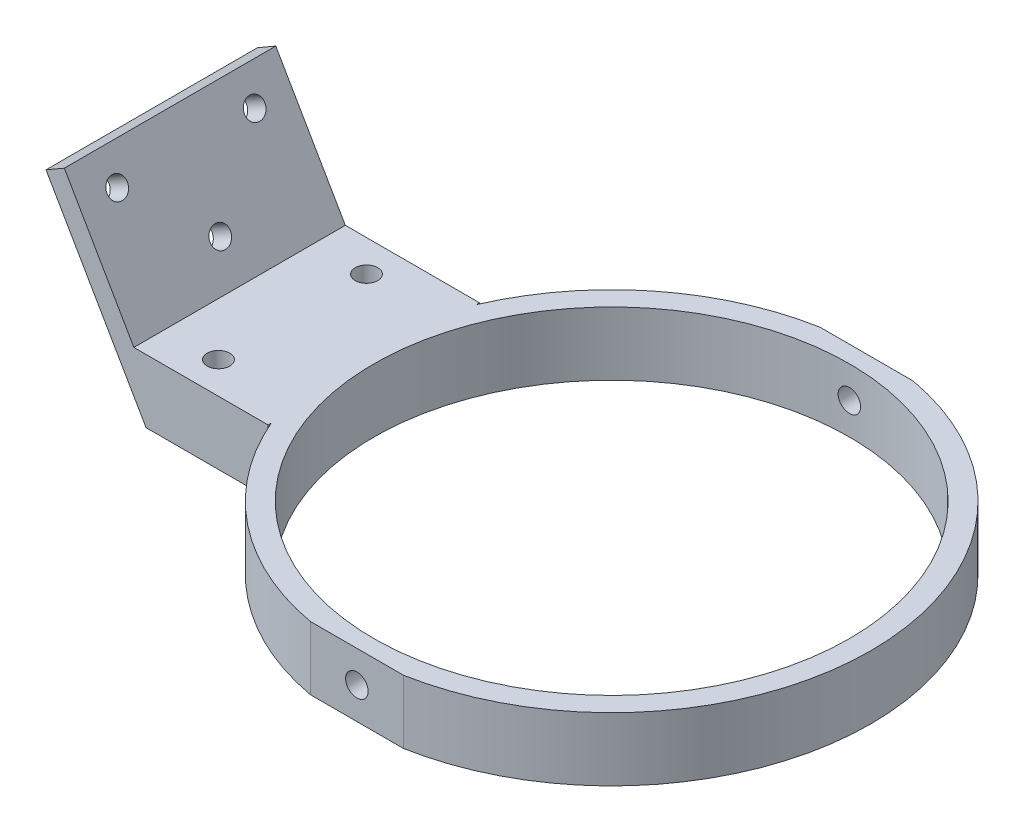
from build123d import *

# Parameters (mm, degrees)
SKETCH1_R                      = 31.115
SKETCH1_R_2                    = 28.575
EXTRUDE_THIN1_DEPTH            = 7.62
BOSS_EXTRUDE1_DEPTH            = 7.62
CUT_EXTRUDE1_REACH             = 67.161
CUT_EXTRUDE1_DIRECTION_2_DEPTH = 66.161025544
SKETCH4_W                      = 25.4
SKETCH4_H                      = 24.038818103
BOSS_EXTRUDE2_DEPTH            = 2.54
F_2_CLEARANCE_HOLE1_D          = 2.4384
F_6_32_TAPPED_HOLE1_D          = 2.7051
SKETCH9_W                      = 20.32
SKETCH9_H                      = 0.508
CUT_EXTRUDE2_DEPTH             = 66.034474296
CUT_EXTRUDE3_DEPTH             = 66.034474296
F_6_32_TAPPED_HOLE2_D          = 2.7051
F_6_32_TAPPED_HOLE2_DEPTH      = 11.176
F_6_32_TAPPED_HOLE2_TIP        = 0.81269403
F_6_32_TAPPED_HOLE3_D          = 2.7051
F_6_32_TAPPED_HOLE3_DEPTH      = 11.176
F_6_32_TAPPED_HOLE3_TIP        = 0.81269403


with BuildPart() as part:
    # Sketch1 → Extrude-Thin1 (new body)
    with BuildSketch(Plane(origin=(0, 0, 0), x_dir=(1, 0, 0), z_dir=(0, 1, 0))):
        Circle(SKETCH1_R)
        Circle(SKETCH1_R_2, mode=Mode.SUBTRACT)
    extrude(amount=EXTRUDE_THIN1_DEPTH)

    # Sketch2 → Boss-Extrude1 (add)
    with BuildSketch(Plane(origin=(0, 7.62, 0), x_dir=(1, 0, 0), z_dir=(0, 1, 0))):
        Polygon((-28.575, 0), (-28.575, -12.7), (-47.625, -12.7), (-47.625, 12.7), (-28.575, 12.7), align=None)
    extrude(amount=-BOSS_EXTRUDE1_DEPTH)

    # Sketch3 → Cut-Extrude1 (cut, up to next)
    with BuildSketch(Plane.XY.offset(12.7), mode=Mode.PRIVATE) as cut_extrude1_sk1:
        Polygon((-47.625, 0), (-43.225590949, 0), (-47.625, 7.62), align=None)
    cut_extrude1_tool1 = extrude(cut_extrude1_sk1.sketch, amount=-CUT_EXTRUDE1_REACH, mode=Mode.PRIVATE) & part.part
    add(cut_extrude1_tool1.solids().sort_by_distance((-46.15853, 2.54, 12.7))[0], mode=Mode.SUBTRACT)

    # Sketch3 → Cut-Extrude1 direction 2 (cut)
    with BuildSketch(Plane.XY.offset(12.7)):
        Polygon((-47.625, 0), (-43.225590949, 0), (-47.625, 7.62), align=None)
    extrude(amount=CUT_EXTRUDE1_DIRECTION_2_DEPTH, mode=Mode.SUBTRACT)

    # Sketch4 → Boss-Extrude2 (add)
    with BuildSketch(Plane(origin=(-32.419193212, -18.717229928, 0), x_dir=(0, 0, 1), z_dir=(-0.8660254037844413, -0.4999999999999954, 0))):
        with Locations((0, 33.632204526)):
            Rectangle(SKETCH4_W, SKETCH4_H)
    extrude(amount=-BOSS_EXTRUDE2_DEPTH)

    # #2 Clearance Hole1 (through all)
    with Locations(Plane(origin=(-30.219488686, -17.447229928, 0), x_dir=(0, 0, -1), z_dir=(0.8660254037844413, 0.4999999999999956, 0))):
        with Locations((-8.255, 41.841613577), (8.255, 41.841613577), (0, 33.586613577)):
            Hole(F_2_CLEARANCE_HOLE1_D / 2)

    # #6-32 Tapped Hole1 (through all)
    with Locations(Plane(origin=(0, 7.62, 0), x_dir=(1, 0, 0), z_dir=(0, 1, 0))):
        with Locations((-38.342060633, -8.89), (-38.342060633, 8.89)):
            Hole(F_6_32_TAPPED_HOLE1_D / 2)

    # Sketch9 → Cut-Extrude2 (cut, through all)
    with BuildSketch(Plane(origin=(0, 7.62, 0), x_dir=(1, 0, 0), z_dir=(0, 1, 0))):
        with Locations((0, 30.861)):
            Rectangle(SKETCH9_W, SKETCH9_H)
    extrude(amount=-CUT_EXTRUDE2_DEPTH, mode=Mode.SUBTRACT)

    # Sketch10 → Cut-Extrude3 (cut, through all)
    with BuildSketch(Plane(origin=(0, 7.62, 0), x_dir=(1, 0, 0), z_dir=(0, 1, 0))):
        Polygon((0, -31.115), (14.742648062, -31.115), (14.742648062, -30.607), (-16.079982159, -30.607), (-16.079982159, -31.115), align=None)
    extrude(amount=-CUT_EXTRUDE3_DEPTH, mode=Mode.SUBTRACT)

    # #6-32 Tapped Hole2
    with Locations(Plane(origin=(0, 0, -30.607), x_dir=(-1, 0, 0), z_dir=(0, 0, -1))):
        with Locations((0, 3.81)):
            Hole(F_6_32_TAPPED_HOLE2_D / 2, depth=F_6_32_TAPPED_HOLE2_DEPTH)
            with Locations((0, 0, -(F_6_32_TAPPED_HOLE2_DEPTH + F_6_32_TAPPED_HOLE2_TIP / 2))):  # 118° drill point
                Cone(0, F_6_32_TAPPED_HOLE2_D / 2, F_6_32_TAPPED_HOLE2_TIP, mode=Mode.SUBTRACT)

    # #6-32 Tapped Hole3
    with Locations(Plane.XY.offset(30.607)):
        with Locations((0, 3.81)):
            Hole(F_6_32_TAPPED_HOLE3_D / 2, depth=F_6_32_TAPPED_HOLE3_DEPTH)
            with Locations((0, 0, -(F_6_32_TAPPED_HOLE3_DEPTH + F_6_32_TAPPED_HOLE3_TIP / 2))):  # 118° drill point
                Cone(0, F_6_32_TAPPED_HOLE3_D / 2, F_6_32_TAPPED_HOLE3_TIP, mode=Mode.SUBTRACT)


solid = part.part
